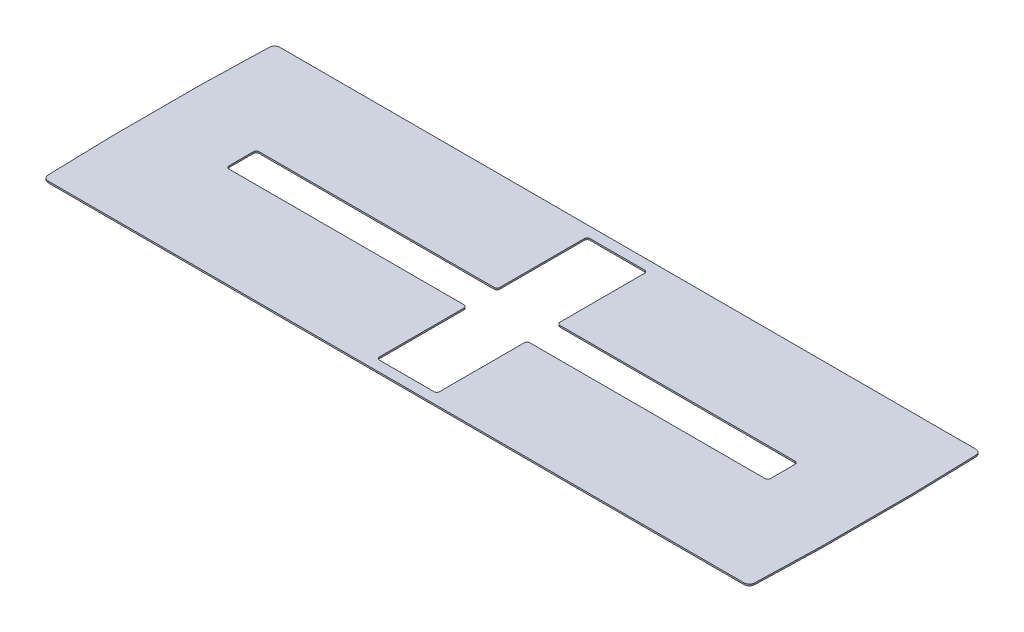
from build123d import *

# Parameters (mm, degrees)
SKETCH1_W           = 1193.8
SKETCH1_H           = 386.08
BOSS_EXTRUDE1_DEPTH = 2.667
SKETCH2_W           = 457.2
SKETCH2_H           = 50.8
CUT_EXTRUDE1_DEPTH  = 628.344534119
SKETCH3_W           = 101.6
SKETCH3_H           = 355.6
CUT_EXTRUDE2_DEPTH  = 628.344534119
FILLET1_R           = 4.7625
CUT_EXTRUDE3_DEPTH  = 628.344534119
BOSS_EXTRUDE2_START = -2.667
BOSS_EXTRUDE2_DEPTH = 2.667


with BuildPart() as part:
    # Sketch1 → Boss-Extrude1 (new body)
    with BuildSketch(Plane(origin=(0, 0, 0), x_dir=(1, 0, 0), z_dir=(0, 1, 0))):
        Rectangle(SKETCH1_W, SKETCH1_H)
    extrude(amount=BOSS_EXTRUDE1_DEPTH)

    # Sketch2 → Cut-Extrude1 (cut, through all)
    with BuildSketch(Plane(origin=(0, 2.667, 0), x_dir=(1, 0, 0), z_dir=(0, 1, 0))):
        with Locations((228.6, 0)):
            Rectangle(SKETCH2_W, SKETCH2_H)
        with Locations((-228.6, 0)):
            Rectangle(SKETCH2_W, SKETCH2_H)
    extrude(amount=-CUT_EXTRUDE1_DEPTH, mode=Mode.SUBTRACT)

    # Sketch3 → Cut-Extrude2 (cut, through all)
    with BuildSketch(Plane(origin=(0, 2.667, 0), x_dir=(1, 0, 0), z_dir=(0, 1, 0))):
        Rectangle(SKETCH3_W, SKETCH3_H)
    extrude(amount=-CUT_EXTRUDE2_DEPTH, mode=Mode.SUBTRACT)

    # Fillet1
    fillet1_edges = [part.edges().sort_by_distance(p)[0] for p in [
        (457.2, 1.3335, -25.4),
        (457.2, 1.3335, 25.4),
        (-457.2, 1.3335, 25.4),
        (-457.2, 1.3335, -25.4),
        (-50.8, 1.3335, -25.4),
        (50.8, 1.3335, -25.4),
        (50.8, 1.3335, 25.4),
        (-50.8, 1.3335, 25.4),
        (-50.8, 1.3335, 177.8),
        (50.8, 1.3335, -177.8),
        (50.8, 1.3335, 177.8),
        (-50.8, 1.3335, -177.8),
    ]]
    fillet(fillet1_edges, radius=FILLET1_R)

    # Sketch4 → Cut-Extrude3 (cut, through all)
    with BuildSketch(Plane.XZ):
        with BuildLine():
            Line((-593.892867101, -186.862490674), (-596.9, -76.2))
            Line((-596.9, -76.2), (-596.9, -193.04))
            Line((-596.9, -193.04), (-587.545210292, -193.04))
            ThreePointArc((-587.545210292, -193.04), (-591.973933823, -191.240704109), (-593.892867101, -186.862490674))
        make_face()
        with BuildLine():
            Line((-596.9, 76.2), (-593.892867101, 186.862490674))
            ThreePointArc((-593.892867101, 186.862490674), (-591.973933823, 191.240704109), (-587.545210292, 193.04))
            Line((-587.545210292, 193.04), (-596.9, 193.04))
            Line((-596.9, 193.04), (-596.9, 76.2))
        make_face()
        with BuildLine():
            Line((596.9, 193.04), (587.545210292, 193.04))
            ThreePointArc((587.545210292, 193.04), (591.973933823, 191.240704109), (593.892867101, 186.862490674))
            Line((593.892867101, 186.862490674), (596.9, 76.2))
            Line((596.9, 76.2), (596.9, 193.04))
        make_face()
        with BuildLine():
            ThreePointArc((593.892867101, -186.862490674), (591.973933823, -191.240704109), (587.545210292, -193.04))
            Line((587.545210292, -193.04), (596.9, -193.04))
            Line((596.9, -193.04), (596.9, -76.2))
            Line((596.9, -76.2), (593.892867101, -186.862490674))
        make_face()
    extrude(amount=-CUT_EXTRUDE3_DEPTH, mode=Mode.SUBTRACT)

    # Sketch5 → Boss-Extrude2 (add)
    with BuildSketch(Plane(origin=(0, 2.667, 0), x_dir=(1, 0, 0), z_dir=(0, 1, 0)).offset(BOSS_EXTRUDE2_START)):
        with BuildLine():
            Line((587.545210292, 195.58), (-587.545210292, 195.58))
            ThreePointArc((-587.545210292, 195.58), (-593.745423235, 193.060985753), (-596.431929825, 186.931486944))
            Line((-596.431929825, 186.931486944), (-599.44, 76.234504501))
            Line((-599.44, 76.234504501), (-599.44, -76.234504501))
            Line((-599.44, -76.234504501), (-596.431929825, -186.931486944))
            ThreePointArc((-596.431929825, -186.931486944), (-593.745423235, -193.060985753), (-587.545210292, -195.58))
            Line((-587.545210292, -195.58), (587.545210292, -195.58))
            ThreePointArc((587.545210292, -195.58), (593.745423235, -193.060985753), (596.431929825, -186.931486944))
            Line((596.431929825, -186.931486944), (599.44, -76.234504501))
            Line((599.44, -76.234504501), (599.44, 76.234504501))
            Line((599.44, 76.234504501), (596.431929825, 186.931486944))
            ThreePointArc((596.431929825, 186.931486944), (593.745423235, 193.060985753), (587.545210292, 195.58))
        make_face()
        with BuildLine():
            Line((596.9, 76.2), (593.892867101, 186.862490674))
            ThreePointArc((593.892867101, 186.862490674), (591.973933823, 191.240704109), (587.545210292, 193.04))
            Line((587.545210292, 193.04), (-587.545210292, 193.04))
            ThreePointArc((-587.545210292, 193.04), (-591.973933823, 191.240704109), (-593.892867101, 186.862490674))
            Line((-593.892867101, 186.862490674), (-596.9, 76.2))
            Line((-596.9, 76.2), (-596.9, -76.2))
            Line((-596.9, -76.2), (-593.892867101, -186.862490674))
            ThreePointArc((-593.892867101, -186.862490674), (-591.973933823, -191.240704109), (-587.545210292, -193.04))
            Line((-587.545210292, -193.04), (587.545210292, -193.04))
            ThreePointArc((587.545210292, -193.04), (591.973933823, -191.240704109), (593.892867101, -186.862490674))
            Line((593.892867101, -186.862490674), (596.9, -76.2))
            Line((596.9, -76.2), (596.9, 76.2))
        make_face(mode=Mode.SUBTRACT)
    extrude(amount=BOSS_EXTRUDE2_DEPTH)


solid = part.part
